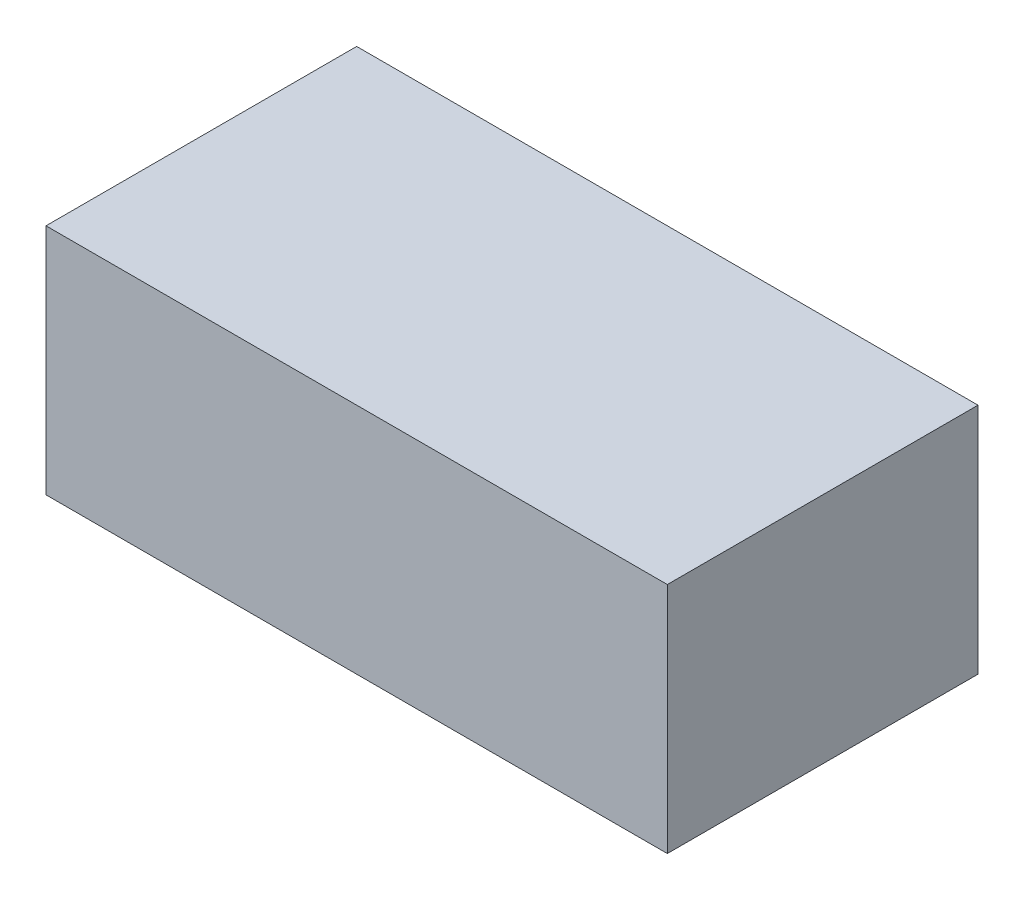
from build123d import *

# Parameters (mm, degrees)
SKETCH5_W           = 40
SKETCH5_H           = 15
BOSS_EXTRUDE4_DEPTH = 20


with BuildPart() as part:
    # Sketch5 → Boss-Extrude4 (new body)
    with BuildSketch(Plane.XY):
        with Locations((20, 7.5)):
            Rectangle(SKETCH5_W, SKETCH5_H)
    extrude(amount=BOSS_EXTRUDE4_DEPTH)


solid = part.part
